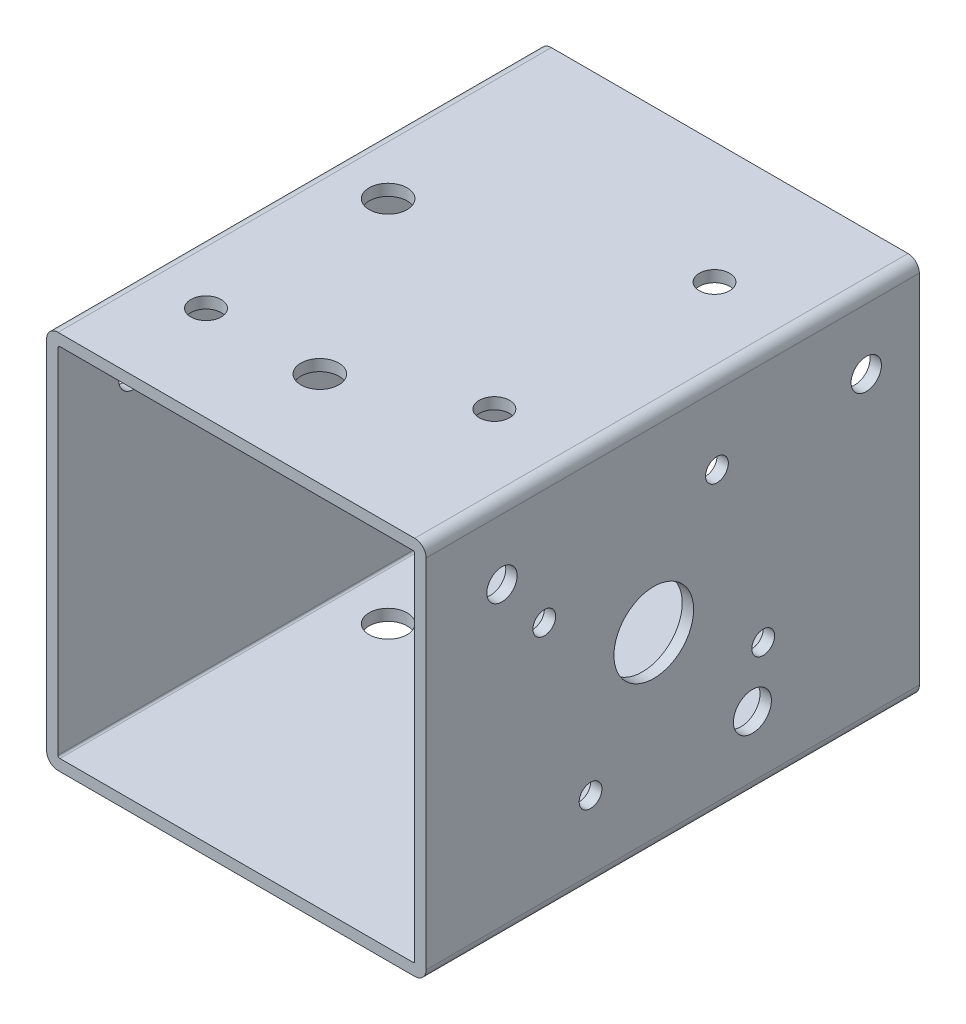
from build123d import *

# Parameters (mm, degrees)
SKETCH1_W                      = 100
SKETCH1_H                      = 100
SKETCH1_W_2                    = 94
SKETCH1_H_2                    = 94
EXTRUDE_THIN1_DEPTH            = 130
FILLET1_R                      = 0.5
FILLET2_R                      = 3
F_8_0_8_DIAMETER_HOLE2_D       = 8
F_8_0_8_DIAMETER_HOLE3_D       = 8
F_10_0_10_DIAMETER_HOLE1_D     = 10
F_10_0_10_DIAMETER_HOLE2_D     = 10
M8X1_25_TAPPED_HOLE1_D         = 6.8
M8X1_25_TAPPED_HOLE1_DEPTH     = 3
M8X1_25_TAPPED_HOLE2_D         = 6.8
M8X1_25_TAPPED_HOLE2_DEPTH     = 3
F_21_0_21_DIAMETER_HOLE1_D     = 21
F_21_0_21_DIAMETER_HOLE1_DEPTH = 3
F_6_0_6_DIAMETER_HOLE1_D       = 6
F_6_0_6_DIAMETER_HOLE1_DEPTH   = 3
F_10_0_10_DIAMETER_HOLE4_D     = 10
F_10_0_10_DIAMETER_HOLE4_DEPTH = 3
SKETCH33_R                     = 4
CUT_EXTRUDE1_DEPTH             = 10


with BuildPart() as part:
    # Sketch1 → Extrude-Thin1 (new body)
    with BuildSketch(Plane.XY):
        Rectangle(SKETCH1_W, SKETCH1_H)
        Rectangle(SKETCH1_W_2, SKETCH1_H_2, mode=Mode.SUBTRACT)
    extrude(amount=EXTRUDE_THIN1_DEPTH)

    # Fillet1
    fillet1_edges = [part.edges().sort_by_distance(p)[0] for p in [
        (47, -47, 65),
        (47, 47, 65),
        (-47, 47, 65),
        (-47, -47, 65),
    ]]
    fillet(fillet1_edges, radius=FILLET1_R)

    # Fillet2
    fillet2_edges = [part.edges().sort_by_distance(p)[0] for p in [
        (50, -50, 65),
        (-50, -50, 65),
        (-50, 50, 65),
        (50, 50, 65),
    ]]
    fillet(fillet2_edges, radius=FILLET2_R)

    # Ø8.0 (8) Diameter Hole2 (through all)
    with Locations(Plane(origin=(0, 50, 0), x_dir=(1, 0, 0), z_dir=(0, 1, 0))):
        with Locations((28, -32), (28, -90)):
            Hole(F_8_0_8_DIAMETER_HOLE2_D / 2)

    # Ø8.0 (8) Diameter Hole3 (through all)
    with Locations(Plane(origin=(50, 0, 0), x_dir=(0, 0, -1), z_dir=(1, 0, 0))):
        with Locations((-14, 31), (-110, 31)):
            Hole(F_8_0_8_DIAMETER_HOLE3_D / 2)

    # Ø10.0 (10) Diameter Hole1 (through all)
    with Locations(Plane(origin=(0, 50, 0), x_dir=(1, 0, 0), z_dir=(0, 1, 0))):
        with Locations((-34, -56)):
            Hole(F_10_0_10_DIAMETER_HOLE1_D / 2)

    # Ø10.0 (10) Diameter Hole2 (through all)
    with Locations(Plane(origin=(50, 0, 0), x_dir=(0, 0, -1), z_dir=(1, 0, 0))):
        with Locations((-44, -31)):
            Hole(F_10_0_10_DIAMETER_HOLE2_D / 2)

    # M8x1.25 Tapped Hole1
    with Locations(Plane.ZY.offset(50)):
        with Locations((56, -15), (56, 35)):
            Hole(M8X1_25_TAPPED_HOLE1_D / 2, depth=M8X1_25_TAPPED_HOLE1_DEPTH)

    # M8x1.25 Tapped Hole2
    with Locations(Plane(origin=(0, -50, 0), x_dir=(-1, 0, 0), z_dir=(0, -1, 0))):
        with Locations((20, -44), (-35, -44)):
            Hole(M8X1_25_TAPPED_HOLE2_D / 2, depth=M8X1_25_TAPPED_HOLE2_DEPTH)

    # Ø21.0 (21) Diameter Hole1
    with Locations(Plane(origin=(50, 0, 0), x_dir=(0, 0, -1), z_dir=(1, 0, 0))):
        with Locations((-70, 0)):
            Hole(F_21_0_21_DIAMETER_HOLE1_D / 2, depth=F_21_0_21_DIAMETER_HOLE1_DEPTH)

    # Ø6.0 (6) Diameter Hole1
    with Locations(Plane(origin=(50, 0, 0), x_dir=(0, 0, -1), z_dir=(1, 0, 0))):
        with Locations((-41.157258279, -16.652364697), (-53.347635303, 28.842741721), (-98.842741721, 16.652364697), (-86.652364697, -28.842741721)):
            Hole(F_6_0_6_DIAMETER_HOLE1_D / 2, depth=F_6_0_6_DIAMETER_HOLE1_DEPTH)

    # Ø10.0 (10) Diameter Hole4
    with Locations(Plane(origin=(0, 50, 0), x_dir=(1, 0, 0), z_dir=(0, 1, 0))):
        with Locations((-3, -105)):
            Hole(F_10_0_10_DIAMETER_HOLE4_D / 2, depth=F_10_0_10_DIAMETER_HOLE4_DEPTH)

    # Sketch33 → Cut-Extrude1 (cut)
    with BuildSketch(Plane(origin=(0, 50, 0), x_dir=(1, 0, 0), z_dir=(0, 1, 0))):
        with Locations(Location((-33, -105, 0), (0, 0, 270))):
            Circle(SKETCH33_R)
    extrude(amount=-CUT_EXTRUDE1_DEPTH, mode=Mode.SUBTRACT)


solid = part.part
